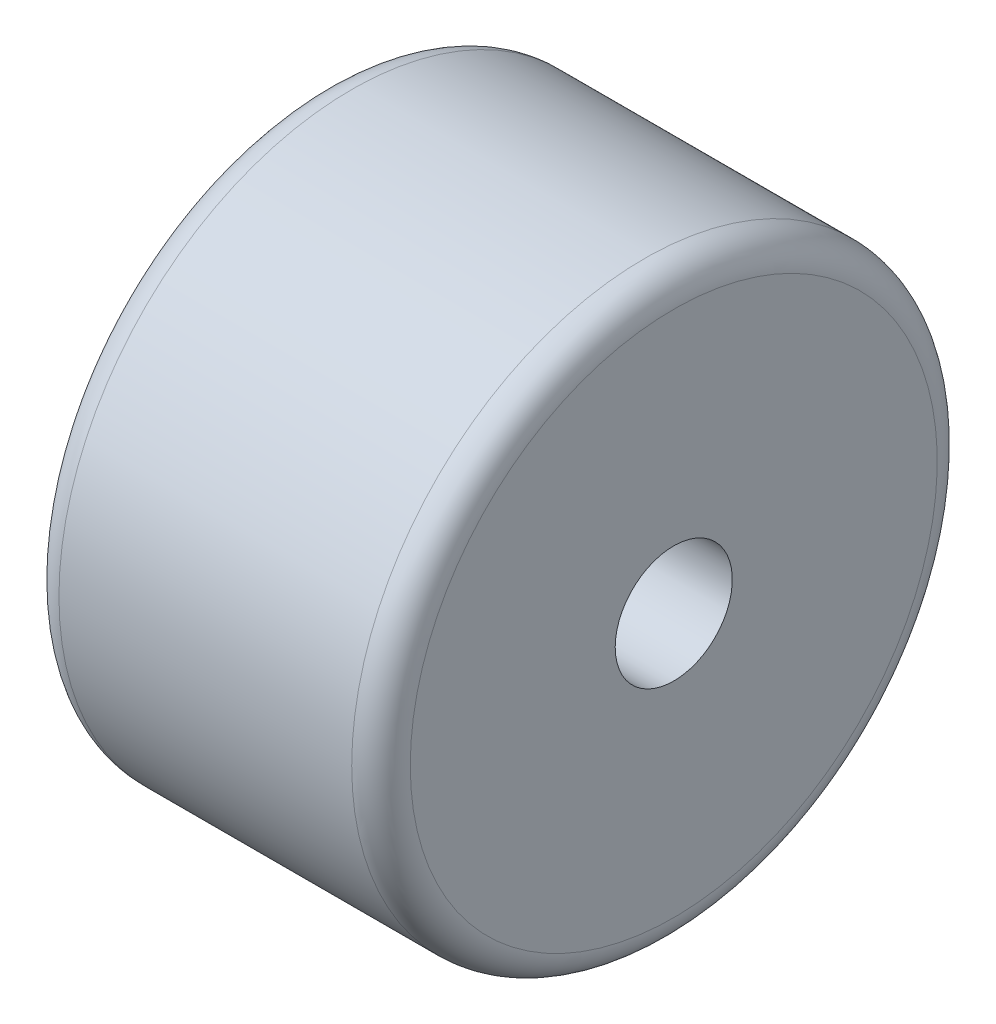
from build123d import *


with BuildPart() as part:
    # Esquisse1 → Révolution1 (revolve)
    with BuildSketch(Plane.XY, mode=Mode.PRIVATE) as r_volution1_sk:
        with BuildLine():
            Line((0, 9), (0, 2))
            Line((0, 2), (12, 2))
            Line((12, 2), (12, 9))
            ThreePointArc((12, 9), (11.707106781, 9.707106781), (11, 10))
            Line((11, 10), (1, 10))
            ThreePointArc((1, 10), (0.292893219, 9.707106781), (0, 9))
        make_face()
    revolve(r_volution1_sk.sketch.rotate(Axis((0, 0, 0), (1, 0, 0)), 90), axis=Axis((0, 0, 0), (1, 0, 0)))


solid = part.part
